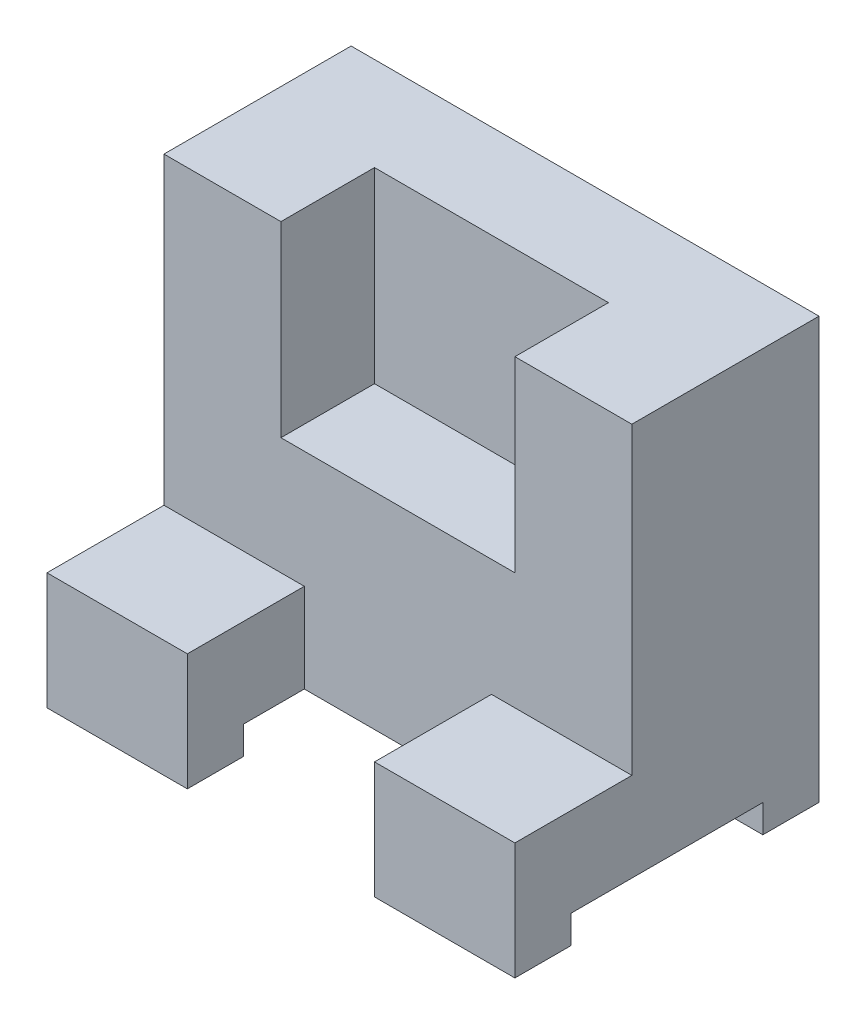
from build123d import *

# Parameters (mm, degrees)
SKETCH2_W               = 100
SKETCH2_H               = 65
BOSS_EXTRUDE1_DEPTH     = 25
SKETCH3_W               = 40
SKETCH3_H               = 65
BOSS_EXTRUDE2_DEPTH     = 50
SKETCH4_W               = 50
SKETCH4_H               = 20
CUT_EXTRUDE1_DEPTH      = 40
CUT_EXTRUDE2_DEPTH      = 139.406105357
CUT_EXTRUDE2_DEPTH_BACK = 139.406105357
SKETCH5_W               = 41
SKETCH5_H               = 5.985076192
CUT_EXTRUDE4_START      = -25
SKETCH6_W               = 40
SKETCH6_H               = 25
CUT_EXTRUDE4_DEPTH      = 25


with BuildPart() as part:
    # Sketch2 → Boss-Extrude1 (new body)
    with BuildSketch(Plane(origin=(0, 0, 0), x_dir=(1, 0, 0), z_dir=(0, 1, 0))):
        Rectangle(SKETCH2_W, SKETCH2_H)
    extrude(amount=BOSS_EXTRUDE1_DEPTH)

    # Sketch3 → Boss-Extrude2 (add, symmetric)
    with BuildSketch(Plane(origin=(0, 0, 0), x_dir=(0, 0, -1), z_dir=(1, 0, 0))):
        with Locations((12.5, 57.5)):
            Rectangle(SKETCH3_W, SKETCH3_H)
    extrude(amount=BOSS_EXTRUDE2_DEPTH, both=True)

    # Sketch4 → Cut-Extrude1 (cut)
    with BuildSketch(Plane(origin=(0, 90, 0), x_dir=(1, 0, 0), z_dir=(0, 1, 0))):
        with Locations((0, 2.5)):
            Rectangle(SKETCH4_W, SKETCH4_H)
    extrude(amount=-CUT_EXTRUDE1_DEPTH, mode=Mode.SUBTRACT)

    # Sketch5 → Cut-Extrude2 (cut, two sides: drawn at the far end of the back side and taken through both)
    with BuildSketch(Plane(origin=(50, 0, 0), x_dir=(0, 0, -1), z_dir=(1, 0, 0)).offset(-CUT_EXTRUDE2_DEPTH_BACK)):
        with Locations((0, 2.992538096)):
            Rectangle(SKETCH5_W, SKETCH5_H)
    extrude(amount=CUT_EXTRUDE2_DEPTH + CUT_EXTRUDE2_DEPTH_BACK, mode=Mode.SUBTRACT)

    # Sketch6 → Cut-Extrude4 (cut)
    with BuildSketch(Plane.XY.offset(32.5).offset(CUT_EXTRUDE4_START)):
        with Locations((0, 12.5)):
            Rectangle(SKETCH6_W, SKETCH6_H)
    extrude(amount=CUT_EXTRUDE4_DEPTH, mode=Mode.SUBTRACT)


solid = part.part
